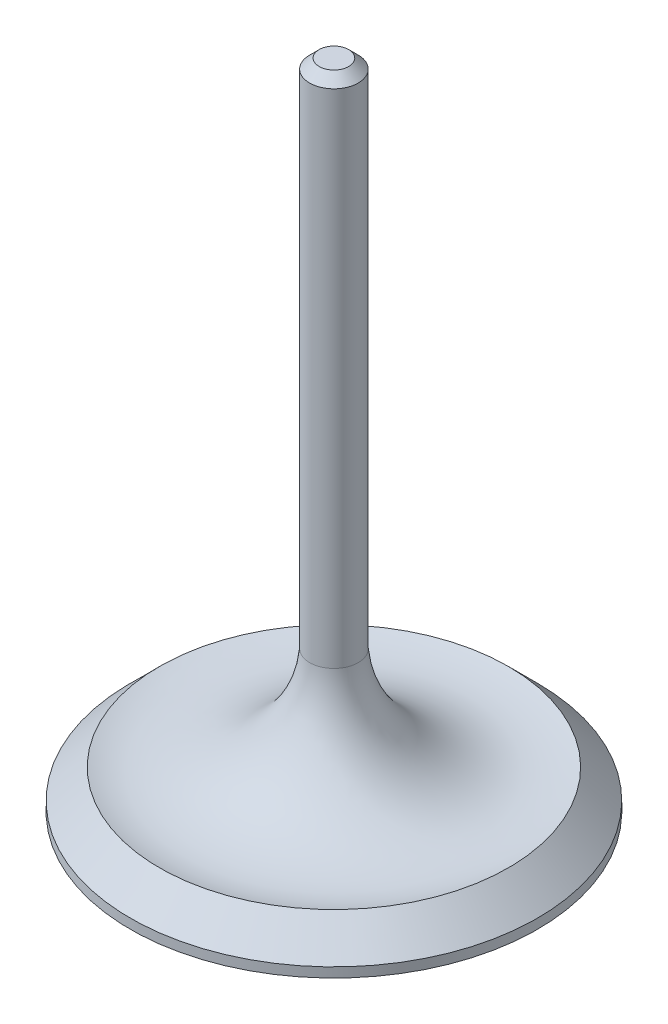
from build123d import *

# Parameters (mm, degrees)
CHAMFER1_SIZE = 1.25


with BuildPart() as part:
    # Sketch1 → Revolve1 (revolve)
    with BuildSketch(Plane(origin=(0, 0, 0), x_dir=(0, 0, -1), z_dir=(1, 0, 0))):
        with BuildLine():
            Line((0, 0), (0, 85.55))
            Line((0, 85.55), (3.18, 85.55))
            Line((3.18, 85.55), (3.18, 18.522021385))
            ThreePointArc((3.18, 18.522021385), (9.786228155, 7.066556842), (22.86, 5.08))
            Line((22.86, 5.08), (26.67, 1.27))
            Line((26.67, 1.27), (26.67, 0))
            Line((26.67, 0), (0, 0))
        make_face()
    revolve(axis=Axis((0, 0, 0), (0, 1, 0)))

    # Chamfer1
    chamfer1_edges = [part.edges().sort_by_distance(p)[0] for p in [
        (0, 85.55, 3.18),
    ]]
    chamfer(chamfer1_edges, length=CHAMFER1_SIZE)


solid = part.part
